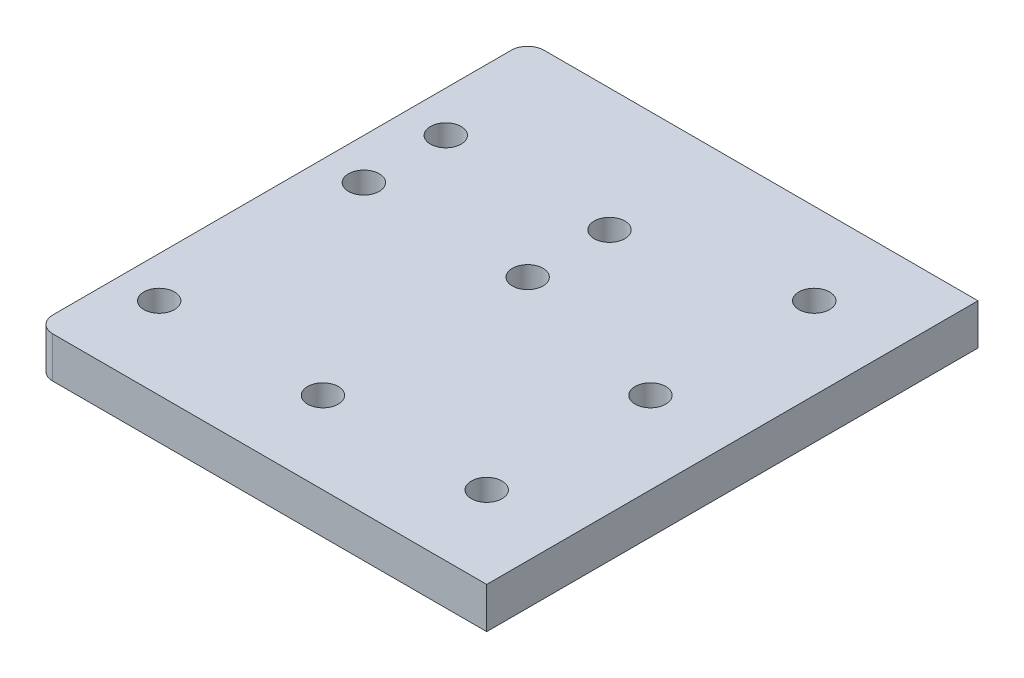
from build123d import *

# Parameters (mm, degrees)
SKETCH1_W           = 69.85
SKETCH1_H           = 76.2
SKETCH1_R           = 2.38125
BOSS_EXTRUDE1_DEPTH = 6.35
FILLET1_R           = 2.54


with BuildPart() as part:
    # Sketch1 → Boss-Extrude1 (new body)
    with BuildSketch(Plane(origin=(0, 0, 0), x_dir=(1, 0, 0), z_dir=(0, 1, 0))):
        Rectangle(SKETCH1_W, SKETCH1_H)
        with Locations(Location((22.225, 0, 0), (0, 0, 270))):
            Circle(SKETCH1_R, mode=Mode.SUBTRACT)
        with Locations(Location((22.225, -25.4, 0), (0, 0, 270))):
            Circle(SKETCH1_R, mode=Mode.SUBTRACT)
        with Locations(Location((22.225, 25.4, 0), (0, 0, 270))):
            Circle(SKETCH1_R, mode=Mode.SUBTRACT)
        with Locations(Location((-28.575, -25.4, 0), (0, 0, 270))):
            Circle(SKETCH1_R, mode=Mode.SUBTRACT)
        with Locations(Location((-28.575, 19.05, 0), (0, 0, 270))):
            Circle(SKETCH1_R, mode=Mode.SUBTRACT)
        with Locations(Location((-28.575, 6.35, 0), (0, 0, 270))):
            Circle(SKETCH1_R, mode=Mode.SUBTRACT)
        with Locations(Location((-3.175, -25.4, 0), (0, 0, 270))):
            Circle(SKETCH1_R, mode=Mode.SUBTRACT)
        with Locations(Location((-3.175, 19.05, 0), (0, 0, 270))):
            Circle(SKETCH1_R, mode=Mode.SUBTRACT)
        with Locations(Location((-3.175, 6.35, 0), (0, 0, 270))):
            Circle(SKETCH1_R, mode=Mode.SUBTRACT)
    extrude(amount=BOSS_EXTRUDE1_DEPTH)

    # Fillet1
    fillet1_edges = [part.edges().sort_by_distance(p)[0] for p in [
        (-34.925, 3.175, 38.1),
        (-34.925, 3.175, -38.1),
    ]]
    fillet(fillet1_edges, radius=FILLET1_R)


solid = part.part
